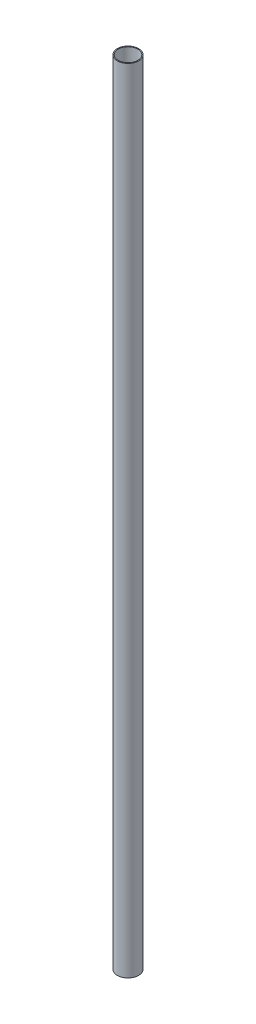
from build123d import *

# Parameters (mm, degrees)
SKETCH_1_R      = 6
SKETCH_1_R_2    = 5.5
EXTRUDE_1_DEPTH = 445


with BuildPart() as part:
    # 草图1 → 凸台-拉伸1 (new body)
    with BuildSketch(Plane(origin=(0, 0, 0), x_dir=(1, 0, 0), z_dir=(0, 1, 0))):
        with Locations(Location((0, 0, 0), (0, 0, 270))):
            Circle(SKETCH_1_R)
        with Locations(Location((0, 0, 0), (0, 0, 270))):
            Circle(SKETCH_1_R_2, mode=Mode.SUBTRACT)
    extrude(amount=EXTRUDE_1_DEPTH)


solid = part.part
